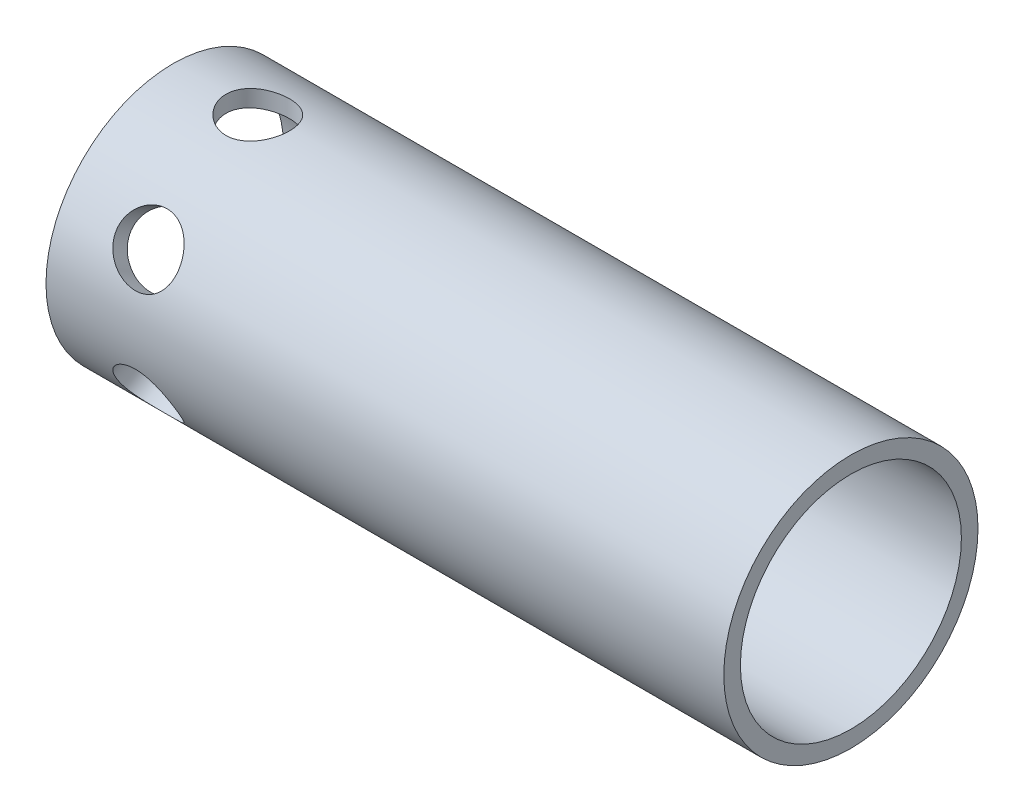
from build123d import *

# Parameters (mm, degrees)
SKETCH1_R          = 9.525
SKETCH1_R_2        = 8.2804
EXTRUDE1_DEPTH     = 25.4
SKETCH2_R          = 2.38125
CUT_EXTRUDE1_DEPTH = 29.750847814
CIRPATTERN1_COUNT  = 3
CIRPATTERN1_ANGLE  = 120


with BuildPart() as part:
    # Sketch1 → Extrude1 (new, symmetric)
    with BuildSketch(Plane(origin=(0, 0, 0), x_dir=(0, 0, -1), z_dir=(1, 0, 0))):
        Circle(SKETCH1_R)
        Circle(SKETCH1_R_2, mode=Mode.SUBTRACT)
    extrude(amount=EXTRUDE1_DEPTH, both=True)

    # Sketch2 → Cut-Extrude1 (cut, symmetric)
    with BuildSketch(Plane(origin=(0, 0, 0), x_dir=(1, 0, 0), z_dir=(0, 1, 0))):
        with Locations(Location((-19.05, 0, 0), (0, 0, 270))):
            Circle(SKETCH2_R)
    cut_extrude1 = extrude(amount=CUT_EXTRUDE1_DEPTH, both=True, mode=Mode.SUBTRACT)

    # CirPattern1: Cut-Extrude1 ×3 about axis
    cirpattern1_axis = Axis((25.4, 0, 0), (-1, 0, 0))
    for i in range(1, CIRPATTERN1_COUNT):
        add(cut_extrude1.rotate(cirpattern1_axis, i * CIRPATTERN1_ANGLE / (CIRPATTERN1_COUNT - 1)), mode=Mode.SUBTRACT)


solid = part.part
